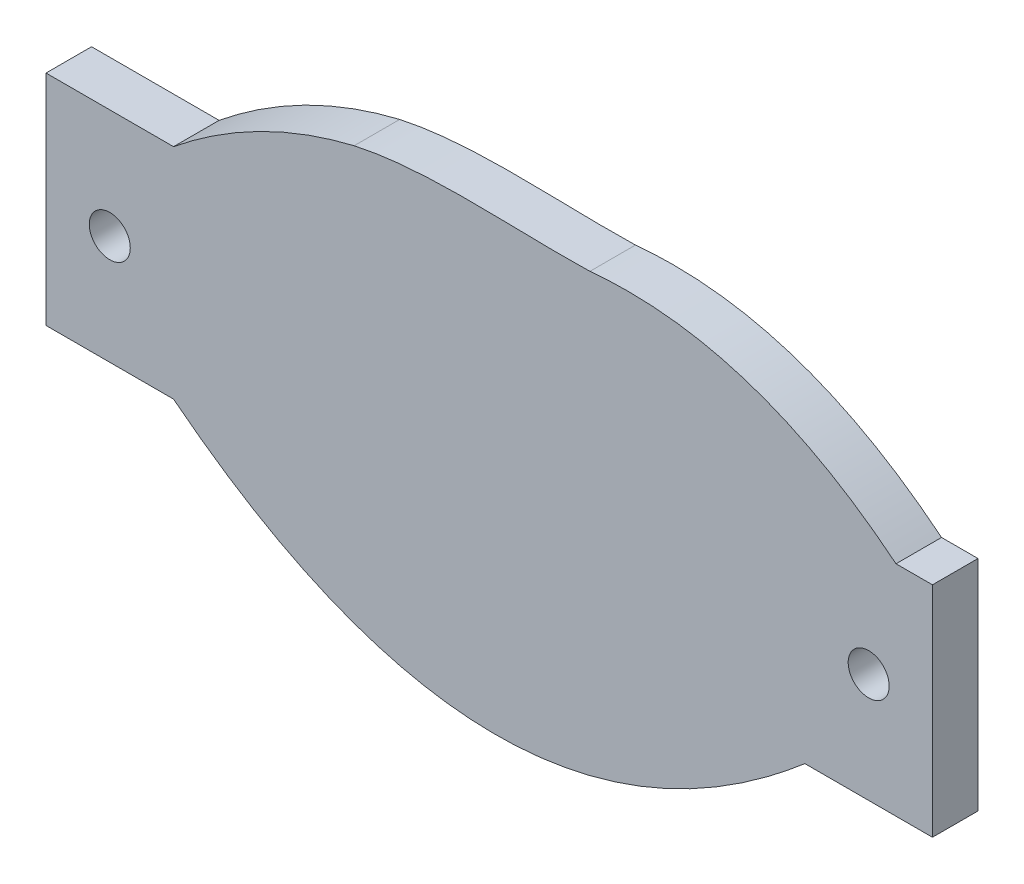
from build123d import *

# Parameters (mm, degrees)
ESBO_O1_R                = 2.25
RESSALTO_EXTRUS_O1_DEPTH = 5


with BuildPart() as part:
    # Esboço1 → Ressalto-extrusão1 (new body)
    with BuildSketch(Plane.XY):
        with BuildLine():
            Line((7, 12), (-7, 12))
            Line((-7, 12), (-7, -12))
            Line((-7, -12), (7, -12))
            add(Edge.make_bspline(
                [(7, -12), (43.097422139, -40.435345183), (76.3, -12)],
                knots=[0, 0, 0, 1, 1, 1], degree=2))
            Line((76.3, -12), (90.3, -12))
            Line((90.3, -12), (90.3, 12))
            Line((90.3, 12), (86.3, 12))
            add(Edge.make_bspline(
                [(52.702753343, 23), (70.621114072, 24.703296344), (86.3, 12)],
                knots=[0, 0, 0, 1, 1, 1], degree=2))
            add(Edge.make_bspline(
                [(26.825, 22), (35.180728242, 23.829481455), (44.09242198, 22.778947834), (52.702753343, 23)],
                knots=[0, 0, 0, 0, 0.489996712, 0.489996712, 0.489996712, 0.489996712], degree=3))
            add(Edge.make_bspline(
                [(7, 12), (16.152998957, 19.434245364), (26.825, 22)],
                knots=[0, 0, 0, 0.533499157, 0.533499157, 0.533499157], degree=2))
        make_face()
        Circle(ESBO_O1_R, mode=Mode.SUBTRACT)
        with Locations((83.3, 0)):
            Circle(ESBO_O1_R, mode=Mode.SUBTRACT)
    extrude(amount=RESSALTO_EXTRUS_O1_DEPTH)


solid = part.part
